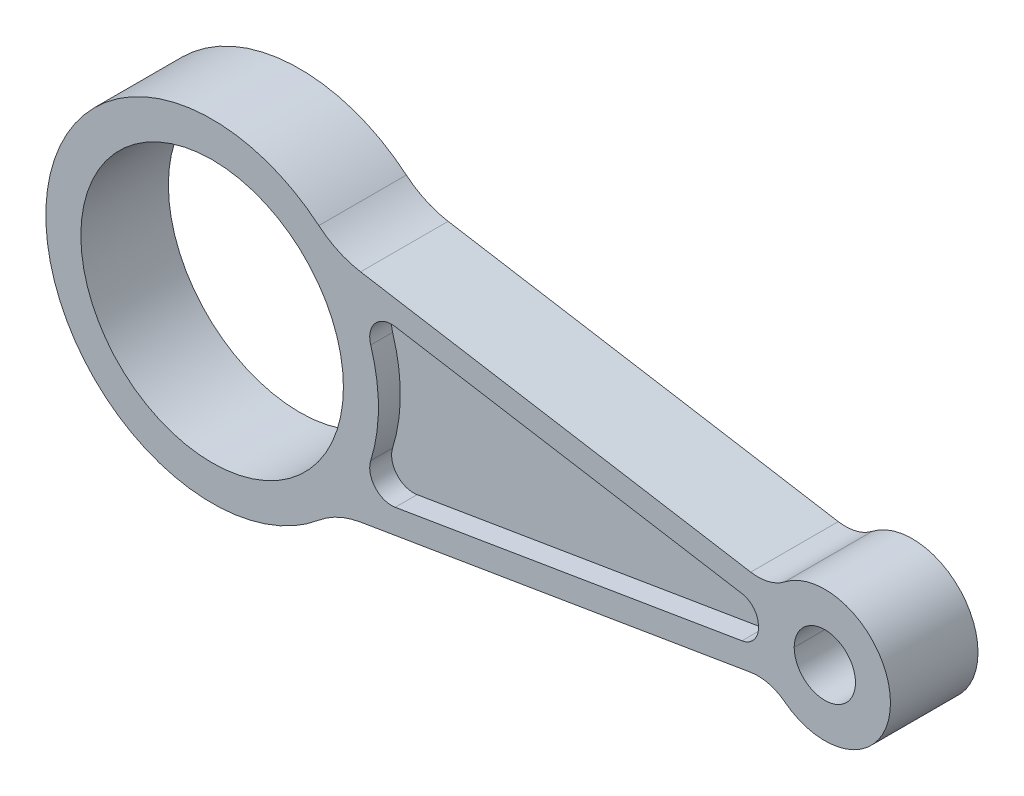
from build123d import *

# Parameters (mm, degrees)
SKETCH1_R          = 30
SKETCH1_R_2        = 7
BASE_EXTRUDE_DEPTH = 20
FILLET1_R          = 10
FILLET2_R          = 20
CUT_EXTRUDE1_DEPTH = 5
CUT_EXTRUDE2_START = -5
CUT_EXTRUDE2_DEPTH = 5


with BuildPart() as part:
    # Sketch1 → Base-Extrude (new body)
    with BuildSketch(Plane.XY):
        with BuildLine():
            Line((27.935473676, 25.760615491), (128.063755469, 9.084385863))
            ThreePointArc((128.063755469, 9.084385863), (155, 0), (128.063755469, -9.084385863))
            Line((128.063755469, -9.084385863), (27.935473676, -25.760615491))
            ThreePointArc((27.935473676, -25.760615491), (-38, 0), (27.935473676, 25.760615491))
        make_face()
        Circle(SKETCH1_R, mode=Mode.SUBTRACT)
        with Locations((140, 0)):
            Circle(SKETCH1_R_2, mode=Mode.SUBTRACT)
    extrude(amount=-BASE_EXTRUDE_DEPTH)

    # Fillet1
    fillet1_edges = [part.edges().sort_by_distance(p)[0] for p in [
        (128.063755469, 9.084385863, -10),
        (128.063755469, -9.084385863, -10),
    ]]
    fillet(fillet1_edges, radius=FILLET1_R)

    # Fillet2
    fillet2_edges = [part.edges().sort_by_distance(p)[0] for p in [
        (27.935473676, 25.760615491, -10),
        (27.935473676, -25.760615491, -10),
    ]]
    fillet(fillet2_edges, radius=FILLET2_R)

    # Sketch2 → Cut-Extrude1 (cut)
    with BuildSketch(Plane.XY):
        with BuildLine():
            Line((41.828554558, 17.870982725), (121.046940728, 4.677267873))
            ThreePointArc((121.046940728, 4.677267873), (123.741079282, 3.147292859), (124.807655013, 0.238406077))
            ThreePointArc((124.807655013, 0.238406077), (123.914202634, -2.958553332), (121.071833732, -4.673121977))
            Line((121.071833732, -4.673121977), (41.828554558, -17.870982725))
            ThreePointArc((41.828554558, -17.870982725), (37.231968897, -16.217361812), (36.238855523, -11.43439331))
            ThreePointArc((36.238855523, -11.43439331), (38, 0), (36.238855523, 11.43439331))
            ThreePointArc((36.238855523, 11.43439331), (37.231968897, 16.217361812), (41.828554558, 17.870982725))
        make_face()
    extrude(amount=-CUT_EXTRUDE1_DEPTH, mode=Mode.SUBTRACT)

    # Sketch3 → Cut-Extrude2 (cut)
    with BuildSketch(Plane(origin=(0, 0, -20), x_dir=(-1, 0, 0), z_dir=(0, 0, -1)).offset(CUT_EXTRUDE2_START)):
        with BuildLine():
            Line((-121.445609231, 4.610870174), (-41.828554558, 17.870982725))
            ThreePointArc((-41.828554558, 17.870982725), (-37.231968897, 16.217361812), (-36.238855523, 11.43439331))
            ThreePointArc((-36.238855523, 11.43439331), (-38, 0), (-36.238855523, -11.43439331))
            ThreePointArc((-36.238855523, -11.43439331), (-37.231968897, -16.217361812), (-41.828554558, -17.870982725))
            Line((-41.828554558, -17.870982725), (-121.433526351, -4.612882562))
            ThreePointArc((-121.433526351, -4.612882562), (-124.132861899, -3.076762276), (-125.194211834, -0.157924451))
            ThreePointArc((-125.194211834, -0.157924451), (-124.244145959, 2.952985869), (-121.445609231, 4.610870174))
        make_face()
    extrude(amount=CUT_EXTRUDE2_DEPTH, mode=Mode.SUBTRACT)


solid = part.part
